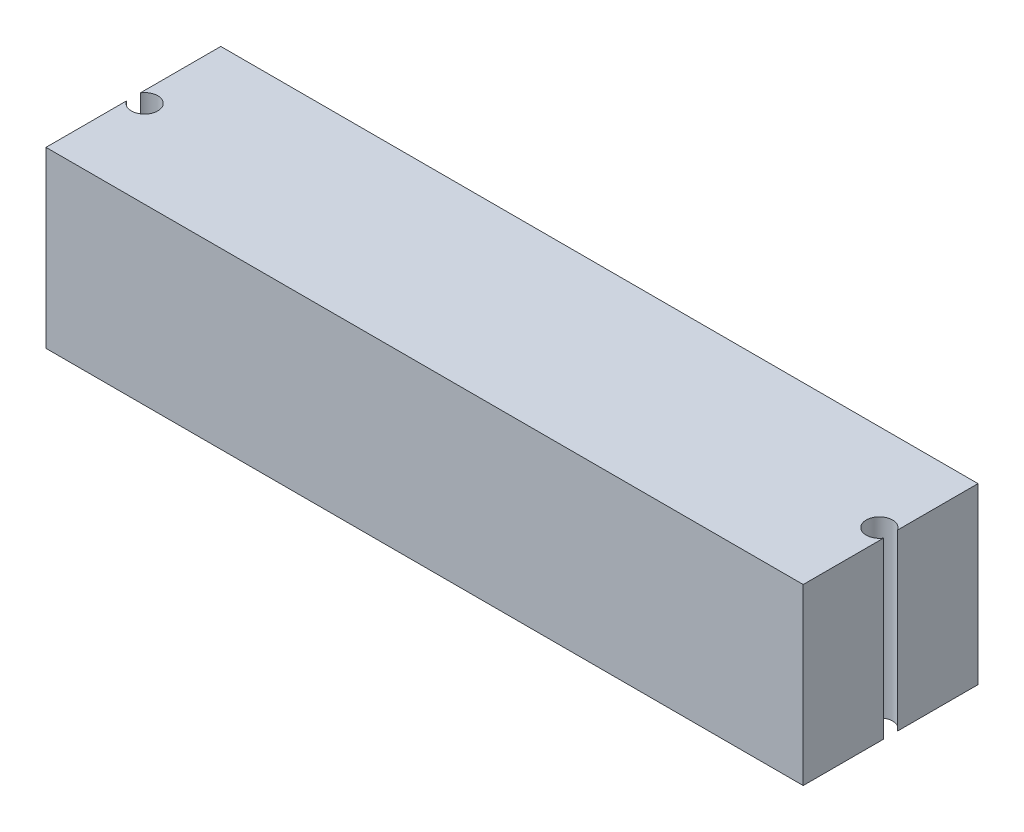
from build123d import *

# Parameters (mm, degrees)
SKETCH_1_W          = 115.8
SKETCH_1_H          = 26.5
EXTRUDE_1_DEPTH     = 26.4
SKETCH_2_R          = 2
CUT_EXTRUDE_5_DEPTH = 106.070564596
SKETCH_3_W          = 26.5
SKETCH_3_H          = 26.4
CUT_EXTRUDE_6_DEPTH = 0.5
SKETCH_4_W          = 26.5
SKETCH_4_H          = 26.4
CUT_EXTRUDE_7_DEPTH = 0.5


with BuildPart() as part:
    # 草图1 → 凸台-拉伸1 (new body)
    with BuildSketch(Plane(origin=(0, 0, 0), x_dir=(1, 0, 0), z_dir=(0, 1, 0))):
        with Locations((42.656744125, -1.955418624)):
            Rectangle(SKETCH_1_W, SKETCH_1_H)
    extrude(amount=EXTRUDE_1_DEPTH)

    # 草图2 → 切除-拉伸5 (cut, through all)
    with BuildSketch(Plane(origin=(0, 26.4, 0), x_dir=(1, 0, 0), z_dir=(0, 1, 0))):
        with Locations(Location((-13.043255875, -1.955418624, 0), (0, 0, 270))):
            Circle(SKETCH_2_R)
        with Locations(Location((98.356744125, -1.955418624, 0), (0, 0, 270))):
            Circle(SKETCH_2_R)
    extrude(amount=-CUT_EXTRUDE_5_DEPTH, mode=Mode.SUBTRACT)

    # 草图3 → 切除-拉伸6 (cut)
    with BuildSketch(Plane(origin=(100.556744125, 0, 0), x_dir=(0, 0, -1), z_dir=(1, 0, 0))):
        with Locations((-1.955418624, 13.2)):
            Rectangle(SKETCH_3_W, SKETCH_3_H)
    extrude(amount=-CUT_EXTRUDE_6_DEPTH, mode=Mode.SUBTRACT)

    # 草图4 → 切除-拉伸7 (cut)
    with BuildSketch(Plane.ZY.offset(15.243255875)):
        with Locations((1.955418624, 13.2)):
            Rectangle(SKETCH_4_W, SKETCH_4_H)
    extrude(amount=-CUT_EXTRUDE_7_DEPTH, mode=Mode.SUBTRACT)


solid = part.part
